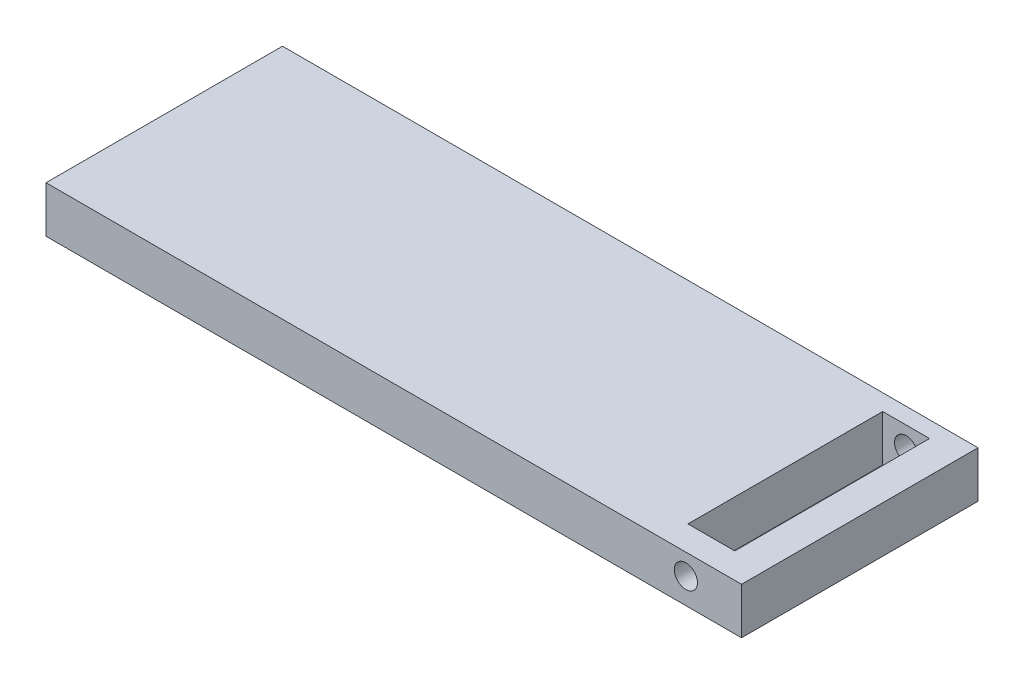
from build123d import *

# Parameters (mm, degrees)
SKETCH1_W           = 150
SKETCH1_H           = 51
BOSS_EXTRUDE1_DEPTH = 10
SKETCH2_W           = 10.1
SKETCH2_H           = 42
CUT_EXTRUDE1_DEPTH  = 80.845162659
SKETCH5_R           = 2.5
CUT_EXTRUDE4_DEPTH  = 92.246917756


with BuildPart() as part:
    # Sketch1 → Boss-Extrude1 (new body)
    with BuildSketch(Plane(origin=(0, 0, 0), x_dir=(1, 0, 0), z_dir=(0, 1, 0))):
        Rectangle(SKETCH1_W, SKETCH1_H)
    extrude(amount=BOSS_EXTRUDE1_DEPTH)

    # Sketch2 → Cut-Extrude1 (cut, through all)
    with BuildSketch(Plane(origin=(0, 10, 0), x_dir=(1, 0, 0), z_dir=(0, 1, 0))):
        with Locations((63, 1)):
            Rectangle(SKETCH2_W, SKETCH2_H)
    extrude(amount=-CUT_EXTRUDE1_DEPTH, mode=Mode.SUBTRACT)

    # Sketch5 → Cut-Extrude4 (cut, through all)
    with BuildSketch(Plane.XY.offset(25.5)):
        with Locations((63, 5.515561539)):
            Circle(SKETCH5_R)
    extrude(amount=-CUT_EXTRUDE4_DEPTH, mode=Mode.SUBTRACT)


solid = part.part
